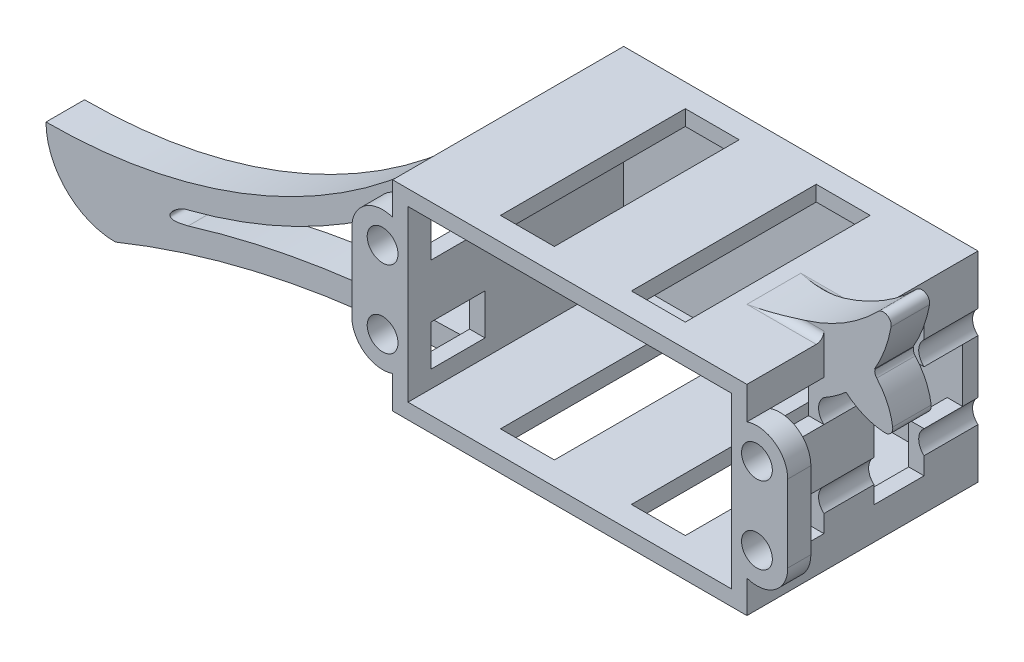
from build123d import *

# Parameters (mm, degrees)
SKETCH1_W            = 46
SKETCH1_H            = 26
BOSS_EXTRUDE3_DEPTH  = 30
SHELL1_T             = -2
SKETCH4_R            = 2
CUT_EXTRUDE2_DEPTH   = 40.974992183
BOSS_EXTRUDE4_START  = -3
BOSS_EXTRUDE4_DEPTH  = 3
SKETCH5_W            = 7
SKETCH5_H            = 2.262987649
SKETCH5_H_2          = 3.03973683
SKETCH5_H_3          = 5.302724479
SKETCH5_W_2          = 6.5
SKETCH5_W_3          = 5
SKETCH5_H_4          = 6.96026317
CUT_EXTRUDE4_DEPTH   = 61.833296804
SKETCH6_W            = 7
SKETCH6_H            = 24
CUT_EXTRUDE6_DEPTH   = 49.753358859
SKETCH7_W            = 6.5
SKETCH7_H            = 2.262987649
SKETCH7_W_2          = 7
SKETCH7_H_2          = 15.302724479
BOSS_EXTRUDE13_DEPTH = 2
BOSS_EXTRUDE16_DEPTH = 5
BOSS_EXTRUDE18_START = -15
BOSS_EXTRUDE18_DEPTH = 5
FILLET1_R            = 1
FILLET2_R            = 1
FILLET3_R            = 1
FILLET4_R            = 1


with BuildPart() as part:
    # Sketch1 → Boss-Extrude3 (new body)
    with BuildSketch(Plane.XY):
        Rectangle(SKETCH1_W, SKETCH1_H)
    extrude(amount=BOSS_EXTRUDE3_DEPTH)

    # Shell1
    shell1_openings = [part.faces().sort_by_distance(p)[0] for p in [
        (0, 0, 30),
    ]]
    offset(amount=SHELL1_T, openings=shell1_openings, kind=Kind.INTERSECTION)

    # Sketch4 → Cut-Extrude2 (cut, through all)
    with BuildSketch(Plane.XY):
        with Locations((24.3, 5)):
            Circle(SKETCH4_R)
        with Locations((24.3, -5)):
            Circle(SKETCH4_R)
        with Locations((-24.3, 5)):
            Circle(SKETCH4_R)
        with Locations((-24.3, -5)):
            Circle(SKETCH4_R)
    extrude(amount=CUT_EXTRUDE2_DEPTH, mode=Mode.SUBTRACT)

    # Sketch2 → Boss-Extrude4 (add)
    with BuildSketch(Plane.XY.offset(30).offset(BOSS_EXTRUDE4_START)):
        with BuildLine():
            ThreePointArc((-23, 8.782856064), (-26.623790008, 8.255764119), (-28.3, 5))
            Line((-28.3, 5), (-28.3, -5))
            ThreePointArc((-28.3, -5), (-26.623790008, -8.255764119), (-23, -8.782856064))
            Line((-23, -8.782856064), (-23, -6.519868415))
            ThreePointArc((-23, -6.519868415), (-26.3, -5), (-23, -3.480131585))
            Line((-23, -3.480131585), (-23, 3.480131585))
            ThreePointArc((-23, 3.480131585), (-26.3, 5), (-23, 6.519868415))
            Line((-23, 6.519868415), (-23, 8.782856064))
        make_face()
        with BuildLine():
            ThreePointArc((28.3, 5), (26.623790008, 8.255764119), (23, 8.782856064))
            Line((23, 8.782856064), (23, 6.519868415))
            ThreePointArc((23, 6.519868415), (26.3, 5), (23, 3.480131585))
            Line((23, 3.480131585), (23, -3.480131585))
            ThreePointArc((23, -3.480131585), (26.3, -5), (23, -6.519868415))
            Line((23, -6.519868415), (23, -8.782856064))
            ThreePointArc((23, -8.782856064), (26.623790008, -8.255764119), (28.3, -5))
            Line((28.3, -5), (28.3, 5))
        make_face()
    extrude(amount=BOSS_EXTRUDE4_DEPTH)

    # Sketch5 → Cut-Extrude4 (cut, through all)
    with BuildSketch(Plane(origin=(23, 0, 0), x_dir=(0, 0, -1), z_dir=(1, 0, 0))):
        with Locations((-23.5, 7.65136224)):
            Rectangle(SKETCH5_W, SKETCH5_H)
        with Locations((-23.5, 5)):
            Rectangle(SKETCH5_W, SKETCH5_H_2)
        with Locations((-23.5, -6.131493825)):
            Rectangle(SKETCH5_W, SKETCH5_H_3)
        with Locations((-10.25, 7.65136224)):
            Rectangle(SKETCH5_W_2, SKETCH5_H)
        Polygon((-7, 6.519868415), (-13.5, 6.519868415), (-13.5, -8.782856064), (-7, -8.782856064), (-7, -3.480131585), (-7, 3.480131585), align=None)
        with Locations((-4.5, 0)):
            Rectangle(SKETCH5_W_3, SKETCH5_H_4)
    extrude(amount=-CUT_EXTRUDE4_DEPTH, mode=Mode.SUBTRACT)

    # Sketch6 → Cut-Extrude6 (cut, through all)
    with BuildSketch(Plane(origin=(0, 13, 0), x_dir=(1, 0, 0), z_dir=(0, 1, 0))):
        with Locations((8.5, -15)):
            Rectangle(SKETCH6_W, SKETCH6_H)
        with Locations((-8.5, -15)):
            Rectangle(SKETCH6_W, SKETCH6_H)
    extrude(amount=-CUT_EXTRUDE6_DEPTH, mode=Mode.SUBTRACT)

    # Sketch7 → Boss-Extrude13 (add)
    with BuildSketch(Plane.ZY.offset(23)):
        with Locations((16.75, 7.65136224)):
            Rectangle(SKETCH7_W, SKETCH7_H)
        with Locations((10.25, 7.65136224)):
            Rectangle(SKETCH7_W, SKETCH7_H)
        Polygon((7, -8.782856064), (20, -8.782856064), (20, 6.519868415), (13.5, 6.519868415), (7, 6.519868415), align=None)
        with Locations((3.5, -1.131493825)):
            Rectangle(SKETCH7_W_2, SKETCH7_H_2)
    extrude(amount=-BOSS_EXTRUDE13_DEPTH)

    # Sketch9 → Boss-Extrude16 (add)
    with BuildSketch(Plane.XY):
        with BuildLine():
            ThreePointArc((15, 0), (13.681980515, 3.181980515), (10.5, 4.5))
            Line((10.5, 4.5), (10.5, -4.5))
            ThreePointArc((10.5, -4.5), (13.681980515, -3.181980515), (15, 0))
        make_face()
        with BuildLine():
            Line((10.5, -4.5), (10.5, 4.5))
            ThreePointArc((10.5, 4.5), (6, 0), (10.5, -4.5))
        make_face()
    extrude(amount=-BOSS_EXTRUDE16_DEPTH)

    # Sketch14 → Boss-Extrude18 (add)
    with BuildSketch(Plane(origin=(0, 0, 0), x_dir=(-1, 0, 0), z_dir=(0, 0, -1)).offset(BOSS_EXTRUDE18_START)):
        with BuildLine():
            ThreePointArc((78, -13), (47.582077651, -6.172528045), (23, 13))
            Line((23, 13), (23, 8.407171524))
            ThreePointArc((23, 8.407171524), (39.649221668, -5.316001993), (59.543496906, -13.667043022))
            add(Edge.make_bspline(
                [(59.543496906, -13.667043022), (61.159670989, -13.928651664), (63.956682001, -16.675845131), (59.543496906, -15.458461907)],
                knots=[0.928317086, 0.928317086, 0.928317086, 0.928317086, 1.928317086, 1.928317086, 1.928317086, 1.928317086], degree=3))
            ThreePointArc((59.543496906, -15.458461907), (41.474455151, -11.372143239), (23, -10))
            Line((23, -10), (23, -13))
            ThreePointArc((23, -13), (46.436083291, -15.271129848), (69, -22))
            ThreePointArc((69, -22), (75.363961031, -19.363961031), (78, -13))
        make_face()
        with BuildLine():
            ThreePointArc((-14, 13), (-22.68093218, 14.742075815), (-30.017611738, 19.698540757))
            ThreePointArc((-30.017611738, 19.698540757), (-31.190497509, 19.883658013), (-31.71341721, 18.817597781))
            ThreePointArc((-31.71341721, 18.817597781), (-30.891492904, 15.814295174), (-29.559153314, 13))
            Line((-29.559153314, 13), (-29.615016918, 13))
            ThreePointArc((-29.615016918, 13), (-29.627736578, 12.534342429), (-29.850028113, 12.12497067))
            ThreePointArc((-29.850028113, 12.12497067), (-31.224443045, 10.041092369), (-31.924156987, 7.644852487))
            ThreePointArc((-31.924156987, 7.644852487), (-31.729252992, 6.90539385), (-31.068831324, 6.519868415))
            Line((-31.068831324, 6.519868415), (-30.762800771, 6.519868415))
            ThreePointArc((-30.762800771, 6.519868415), (-28.154195214, 7.143228754), (-25.876056336, 8.558673673))
            ThreePointArc((-25.876056336, 8.558673673), (-24.48859005, 7.467945536), (-23, 6.519868415))
            Line((-23, 6.519868415), (-23, 13))
            Line((-23, 13), (-14, 13))
        make_face()
    extrude(amount=-BOSS_EXTRUDE18_DEPTH)

    # Fillet1
    fillet1_edges = [part.edges().sort_by_distance(p)[0] for p in [
        (-23, 8.407171524, 17.5),
    ]]
    fillet(fillet1_edges, radius=FILLET1_R)

    # Fillet2
    fillet2_edges = [part.edges().sort_by_distance(p)[0] for p in [
        (-23, -10, 17.5),
    ]]
    fillet(fillet2_edges, radius=FILLET2_R)

    # Fillet3
    fillet3_edges = [part.edges().sort_by_distance(p)[0] for p in [
        (18.5, 13, 15),
    ]]
    fillet(fillet3_edges, radius=FILLET3_R)

    # Fillet4
    fillet4_edges = [part.edges().sort_by_distance(p)[0] for p in [
        (18.5, 13, 20),
    ]]
    fillet(fillet4_edges, radius=FILLET4_R)


solid = part.part
